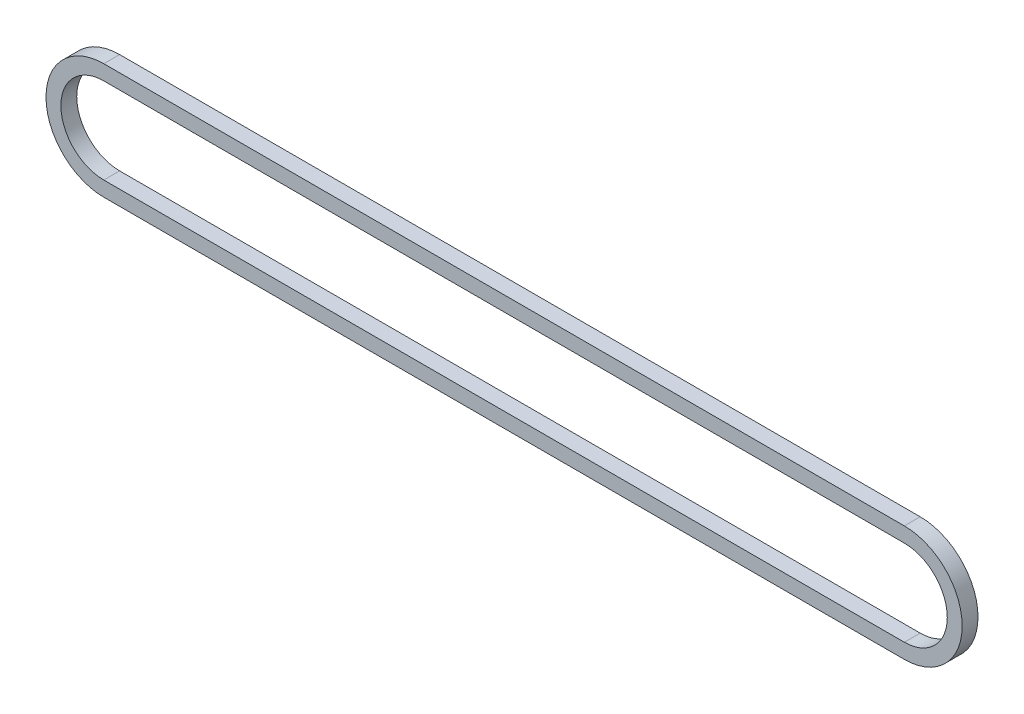
from build123d import *

# Parameters (mm, degrees)
EXTRUDE_1_DEPTH = 3.19


with BuildPart() as part:
    # 草图1 → 凸台-拉伸1 (new, symmetric)
    with BuildSketch(Plane.XY):
        with BuildLine():
            Line((-161.275, 23.295), (161.275, 23.295))
            ThreePointArc((161.275, 23.295), (184.57, 0), (161.275, -23.295))
            Line((161.275, -23.295), (-161.275, -23.295))
            ThreePointArc((-161.275, -23.295), (-184.57, 0), (-161.275, 23.295))
        make_face()
        with BuildLine():
            Line((-161.275, 17.295), (161.275, 17.295))
            ThreePointArc((161.275, 17.295), (178.57, 0), (161.275, -17.295))
            Line((161.275, -17.295), (-161.275, -17.295))
            ThreePointArc((-161.275, -17.295), (-178.57, 0), (-161.275, 17.295))
        make_face(mode=Mode.SUBTRACT)
    extrude(amount=EXTRUDE_1_DEPTH, both=True)


solid = part.part
